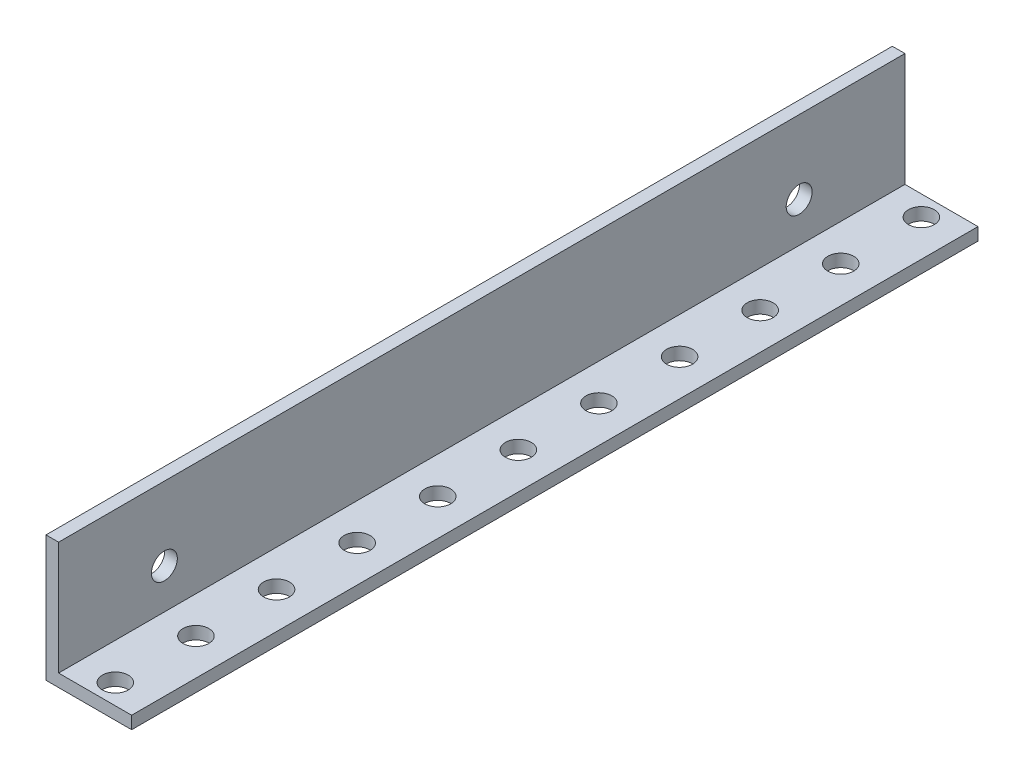
from build123d import *

# Parameters (mm, degrees)
EXTRUDE1_DEPTH            = 53.34
LPATTERN1_COUNT           = 6
LPATTERN1_PITCH           = 10.16
LPATTERN1_COL_COUNT       = 6
LPATTERN1_COL_PITCH       = 10.16
F_4_CLEARANCE_HOLE2_D     = 3.2639
F_4_CLEARANCE_HOLE2_DEPTH = 15.24
F_4_CLEARANCE_HOLE2_TIP   = 0.980574487


with BuildPart() as part:
    # Sketch1 → Extrude1 (new, symmetric)
    with BuildSketch(Plane.XY):
        Polygon((0, 0), (0, 15.875), (1.5875, 15.875), (1.5875, 1.5875), (10.795, 1.5875), (10.795, 0), align=None)
    extrude(amount=EXTRUDE1_DEPTH, both=True)

    # Sketch3 → #4 Clearance Hole1 (revolve, cut)
    with BuildSketch(Plane(origin=(6.1976, 1.5875, 0), x_dir=(0, 0, 1), z_dir=(1, 0, 0))):
        Polygon((0, 0), (0, 16.220574487), (1.63195, 15.24), (1.63195, 0), align=None)
    f_4_clearance_hole1 = revolve(axis=Axis((6.1976, 7.9375, 0), (0, -1, 0)), mode=Mode.SUBTRACT)

    # LPattern1: #4 Clearance Hole1 ×6
    with Locations(*[(0, 0, i * LPATTERN1_PITCH) for i in range(1, LPATTERN1_COUNT)]):
        add(f_4_clearance_hole1, mode=Mode.SUBTRACT)

    # LPattern1 col: #4 Clearance Hole1 ×6
    with Locations(*[(0, 0, -i * LPATTERN1_COL_PITCH) for i in range(1, LPATTERN1_COL_COUNT)]):
        add(f_4_clearance_hole1, mode=Mode.SUBTRACT)

    # #4 Clearance Hole2
    with Locations(Plane(origin=(1.5875, 6.62178, -40.005), x_dir=(0, 1, 0), z_dir=(1, 0, 0))):
        with Locations((0, 0), (0, 80.01)):
            Hole(F_4_CLEARANCE_HOLE2_D / 2, depth=F_4_CLEARANCE_HOLE2_DEPTH)
            with Locations((0, 0, -(F_4_CLEARANCE_HOLE2_DEPTH + F_4_CLEARANCE_HOLE2_TIP / 2))):  # 118° drill point
                Cone(0, F_4_CLEARANCE_HOLE2_D / 2, F_4_CLEARANCE_HOLE2_TIP, mode=Mode.SUBTRACT)


solid = part.part
